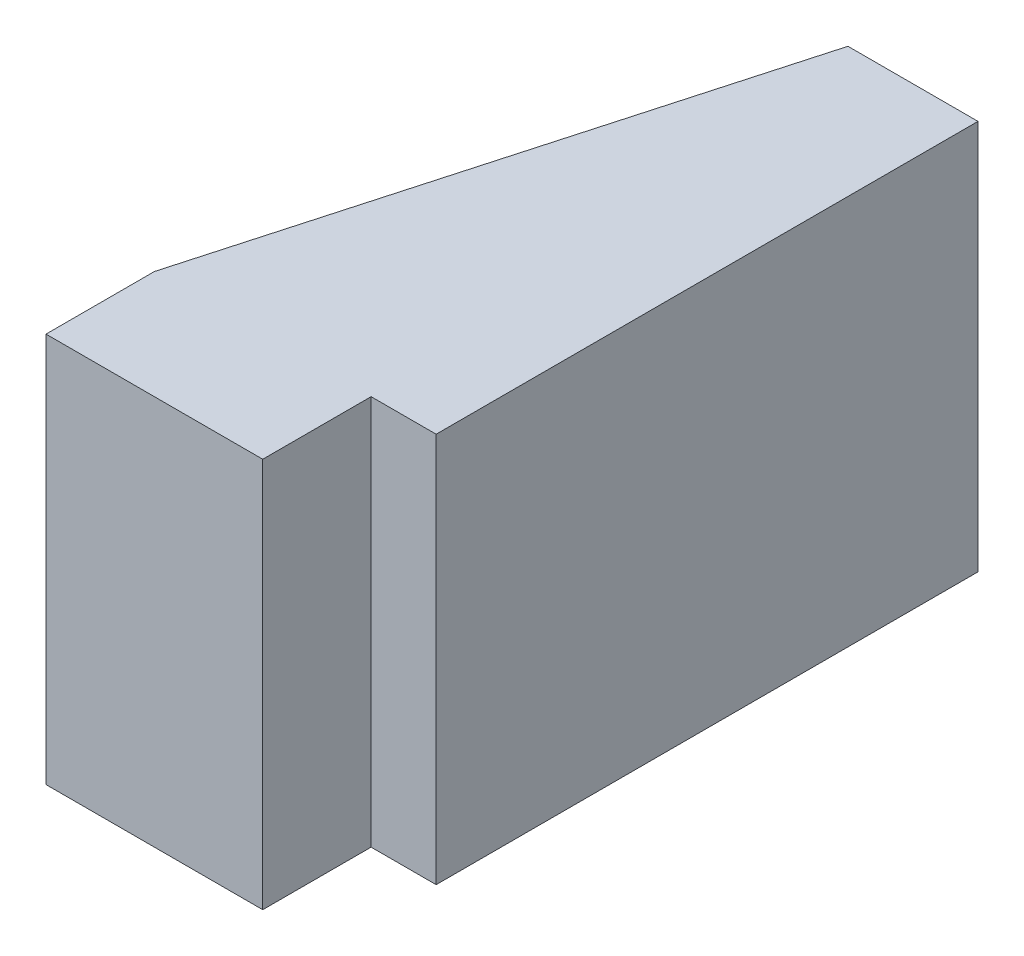
from build123d import *

# Parameters (mm, degrees)
BOSS_EXTRU_1_DEPTH = 18


with BuildPart() as part:
    # Esquisse1 → Boss.-Extru.1 (new body)
    with BuildSketch(Plane(origin=(0, 0, 0), x_dir=(1, 0, 0), z_dir=(0, 1, 0))):
        Polygon((9.873508353, 12.207637232), (9.873508353, -12.792362768), (6.873508353, -12.792362768), (6.873508353, -17.792362768), (-3.126491647, -17.792362768), (-3.126491647, -12.792362768), (3.873508353, 12.207637232), (6.873508353, 12.207637232), align=None)
    extrude(amount=BOSS_EXTRU_1_DEPTH)


solid = part.part
